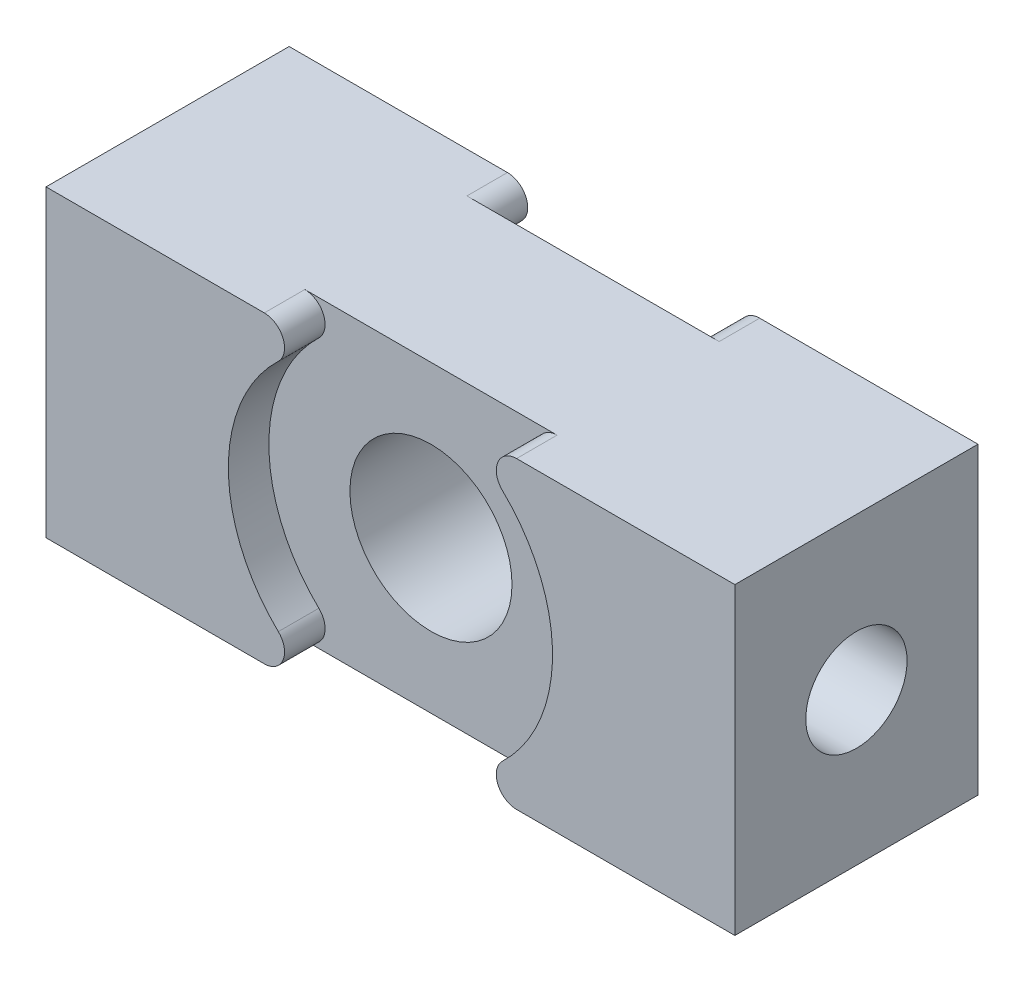
from build123d import *

# Parameters (mm, degrees)
SKETCH_1_W          = 34
SKETCH_1_H          = 12
EXTRUDE_1_DEPTH     = 15
SKETCH_2_R          = 4
CUT_EXTRUDE_1_DEPTH = 26.651510677
M6X1_0_2_D          = 5
M6X1_0_2_DEPTH      = 10
M6X1_0_2_TIP        = 1.502151548
M6X1_0_1_D          = 5
M6X1_0_1_DEPTH      = 10
M6X1_0_1_TIP        = 1.502151548
SKETCH_11_R         = 8
CUT_EXTRUDE_2_DEPTH = 2
CUT_EXTRUDE_START   = -2
SKETCH_12_R         = 8
CUT_EXTRUDE_3_DEPTH = 2
FILLET_1_R          = 1


with BuildPart() as part:
    # 草图1 → 凸台-拉伸1 (new body)
    with BuildSketch(Plane(origin=(0, 0, 0), x_dir=(1, 0, 0), z_dir=(0, 1, 0))):
        Rectangle(SKETCH_1_W, SKETCH_1_H)
    extrude(amount=EXTRUDE_1_DEPTH)

    # 草图2 → 切除-拉伸1 (cut, through all)
    with BuildSketch(Plane(origin=(0, 0, -6), x_dir=(-1, 0, 0), z_dir=(0, 0, -1))):
        with Locations((0, 7.5)):
            Circle(SKETCH_2_R)
    extrude(amount=-CUT_EXTRUDE_1_DEPTH, mode=Mode.SUBTRACT)

    # M6x1.0 螺纹孔2
    with Locations(Plane.ZY.offset(17)):
        with Locations((0, 7.5)):
            Hole(M6X1_0_2_D / 2, depth=M6X1_0_2_DEPTH)
            with Locations((0, 0, -(M6X1_0_2_DEPTH + M6X1_0_2_TIP / 2))):  # 118° drill point
                Cone(0, M6X1_0_2_D / 2, M6X1_0_2_TIP, mode=Mode.SUBTRACT)

    # M6x1.0 螺纹孔1
    with Locations(Plane(origin=(17, 0, 0), x_dir=(0, 0, -1), z_dir=(1, 0, 0))):
        with Locations((0, 7.5)):
            Hole(M6X1_0_1_D / 2, depth=M6X1_0_1_DEPTH)
            with Locations((0, 0, -(M6X1_0_1_DEPTH + M6X1_0_1_TIP / 2))):  # 118° drill point
                Cone(0, M6X1_0_1_D / 2, M6X1_0_1_TIP, mode=Mode.SUBTRACT)

    # 草图11 → 切除-拉伸2 (cut)
    with BuildSketch(Plane.XY.offset(6)):
        with Locations((0, 7.5)):
            Circle(SKETCH_11_R)
    extrude(amount=-CUT_EXTRUDE_2_DEPTH, mode=Mode.SUBTRACT)

    # 草图12 → 切除-拉伸3 (cut)
    with BuildSketch(Plane(origin=(0, 0, -6), x_dir=(-1, 0, 0), z_dir=(0, 0, -1)).offset(CUT_EXTRUDE_START)):
        with Locations((0, 7.5)):
            Circle(SKETCH_12_R)
    extrude(amount=CUT_EXTRUDE_3_DEPTH, mode=Mode.SUBTRACT)

    # 圆角1
    fillet_1_edges = [part.edges().sort_by_distance(p)[0] for p in [
        (2.783882181, 0, 5),
        (-2.783882181, 0, 5),
        (-2.783882181, 15, 5),
        (2.783882181, 15, 5),
        (-2.783882181, 0, -5),
        (2.783882181, 0, -5),
        (2.783882181, 15, -5),
        (-2.783882181, 15, -5),
    ]]
    fillet(fillet_1_edges, radius=FILLET_1_R)


solid = part.part
